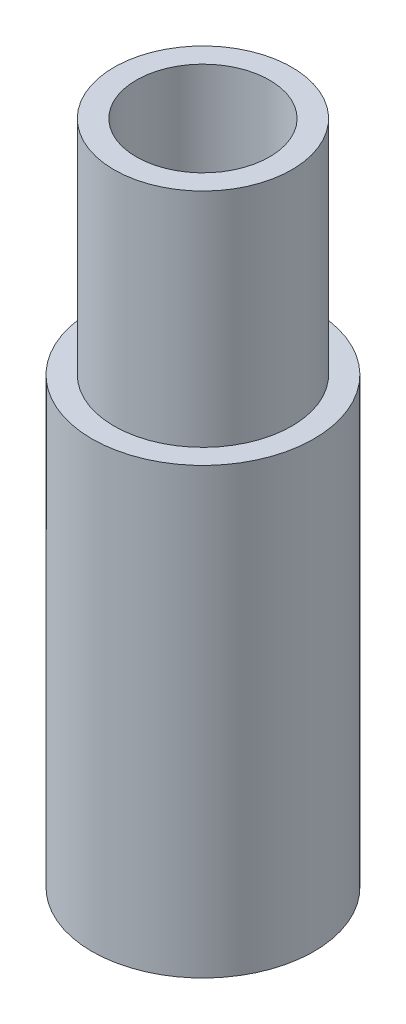
from build123d import *

# Parameters (mm, degrees)
SKETCH_1_R          = 5
EXTRUDE_1_DEPTH     = 20
SKETCH_2_R          = 4.003478206
EXTRUDE_2_DEPTH     = 10
SKETCH_3_R          = 3
CUT_EXTRUDE_1_DEPTH = 10


with BuildPart() as part:
    # 草图1 → 凸台-拉伸1 (new body)
    with BuildSketch(Plane(origin=(0, 0, 0), x_dir=(1, 0, 0), z_dir=(0, 1, 0))):
        with Locations(Location((0, 0, 0), (0, 0, 270))):
            Circle(SKETCH_1_R)
    extrude(amount=EXTRUDE_1_DEPTH)

    # 草图2 → 凸台-拉伸2 (add)
    with BuildSketch(Plane(origin=(0, 20, 0), x_dir=(1, 0, 0), z_dir=(0, 1, 0))):
        with Locations(Location((0, 0, 0), (0, 0, 270))):
            Circle(SKETCH_2_R)
    extrude(amount=EXTRUDE_2_DEPTH)

    # 草图3 → 切除-拉伸1 (cut)
    with BuildSketch(Plane(origin=(0, 30, 0), x_dir=(1, 0, 0), z_dir=(0, 1, 0))):
        with Locations(Location((0, 0, 0), (0, 0, 270))):
            Circle(SKETCH_3_R)
    extrude(amount=-CUT_EXTRUDE_1_DEPTH, mode=Mode.SUBTRACT)


solid = part.part
